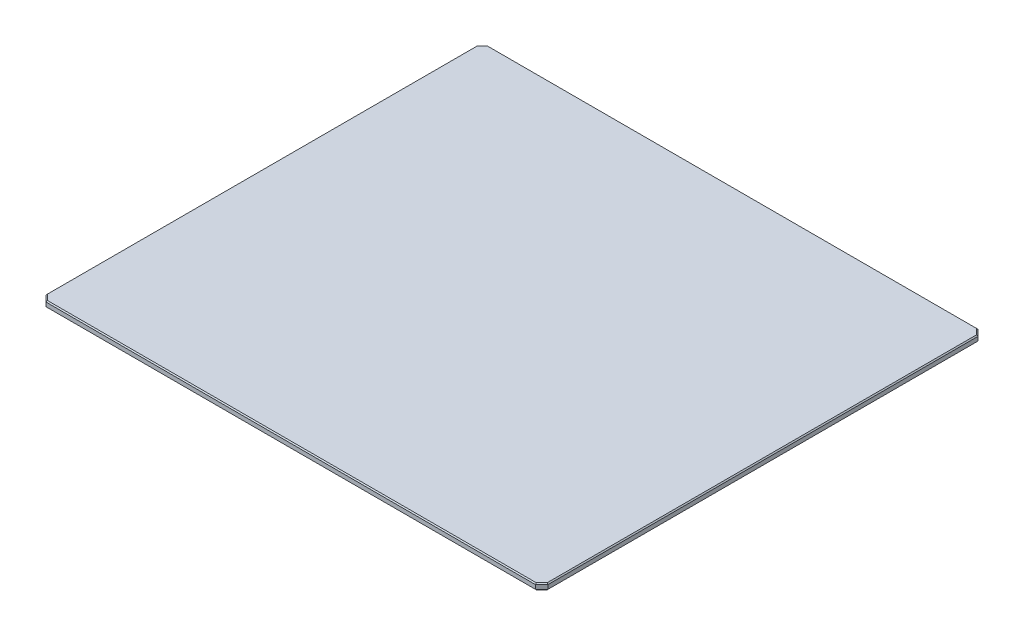
from build123d import *

# Parameters (mm, degrees)
CROQUIS1_W              = 245
CROQUIS1_H              = 215.984697531
SALIENTE_EXTRUIR1_DEPTH = 3
CHAFL_N1_SIZE           = 3
CHAFL_N2_SIZE           = 0.5
CHAFL_N3_SIZE           = 0.5


with BuildPart() as part:
    # Croquis1 → Saliente-Extruir1 (new body)
    with BuildSketch(Plane(origin=(0, 78.978806339, 0), x_dir=(1, 0, 0), z_dir=(0, 1, 0))):
        with Locations((-29.028784153, -174.782074069)):
            Rectangle(CROQUIS1_W, CROQUIS1_H)
    extrude(amount=SALIENTE_EXTRUIR1_DEPTH)

    # Chaflán1
    chafl_n1_edges = [part.edges().sort_by_distance(p)[0] for p in [
        (93.471215847, 80.478806339, 66.789725304),
        (93.471215847, 80.478806339, 282.774422835),
        (-151.528784153, 80.478806339, 282.774422835),
        (-151.528784153, 80.478806339, 66.789725304),
    ]]
    chamfer(chafl_n1_edges, length=CHAFL_N1_SIZE)

    # Chaflán2
    chafl_n2_edges = [part.edges().sort_by_distance(p)[0] for p in [
        (-151.528784153, 81.978806339, 174.78207407),
        (-29.028784153, 81.978806339, 66.789725304),
        (-29.028784153, 81.978806339, 282.774422835),
        (93.471215847, 81.978806339, 174.78207407),
        (91.971215847, 81.978806339, 281.274422835),
        (91.971215847, 81.978806339, 68.289725304),
        (-150.028784153, 81.978806339, 281.274422835),
        (-150.028784153, 81.978806339, 68.289725304),
    ]]
    chamfer(chafl_n2_edges, length=CHAFL_N2_SIZE)

    # Chaflán3
    chafl_n3_edges = [part.edges().sort_by_distance(p)[0] for p in [
        (-151.528784153, 78.978806339, 174.78207407),
        (-29.028784153, 78.978806339, 66.789725304),
        (93.471215847, 78.978806339, 174.78207407),
        (-29.028784153, 78.978806339, 282.774422835),
        (91.971215847, 78.978806339, 281.274422835),
        (91.971215847, 78.978806339, 68.289725304),
        (-150.028784153, 78.978806339, 281.274422835),
        (-150.028784153, 78.978806339, 68.289725304),
    ]]
    chamfer(chafl_n3_edges, length=CHAFL_N3_SIZE)


solid = part.part
